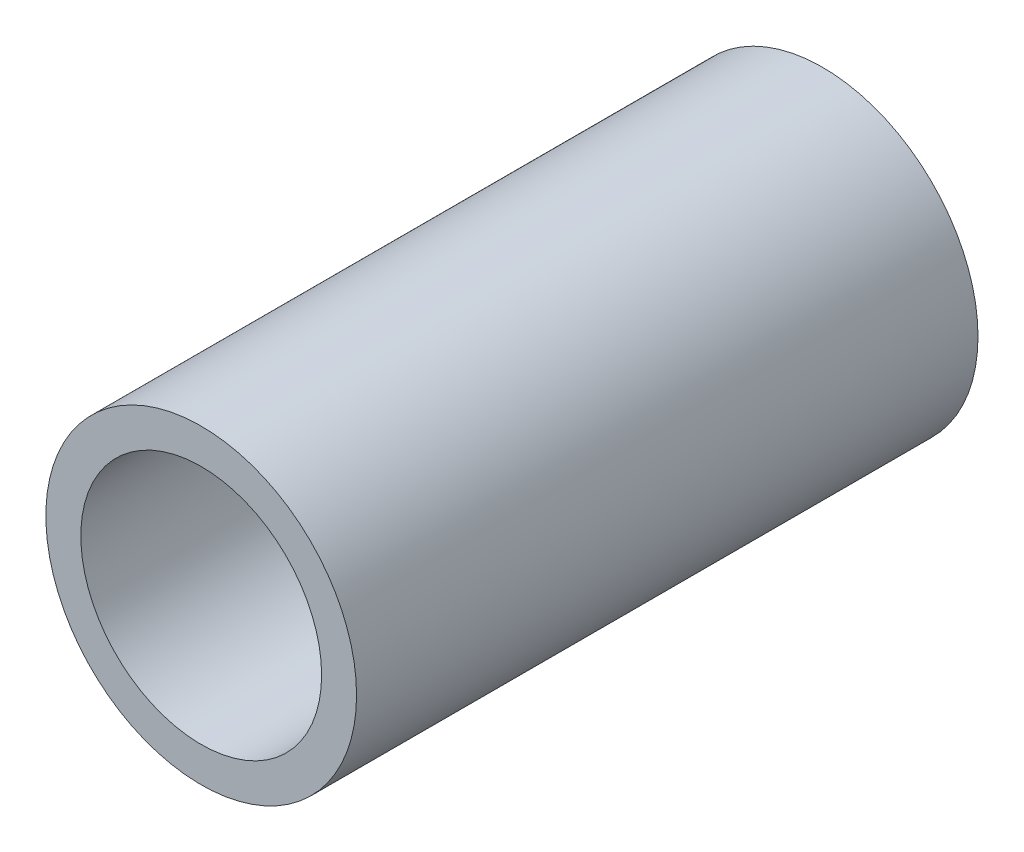
from build123d import *

# Parameters (mm, degrees)
ESQUISSE1_R        = 2
ESQUISSE1_R_2      = 1.55
BOSS_EXTRU_1_DEPTH = 4


with BuildPart() as part:
    # Esquisse1 → Boss.-Extru.1 (new, symmetric)
    with BuildSketch(Plane.XY):
        Circle(ESQUISSE1_R)
        Circle(ESQUISSE1_R_2, mode=Mode.SUBTRACT)
    extrude(amount=BOSS_EXTRU_1_DEPTH, both=True)


solid = part.part
